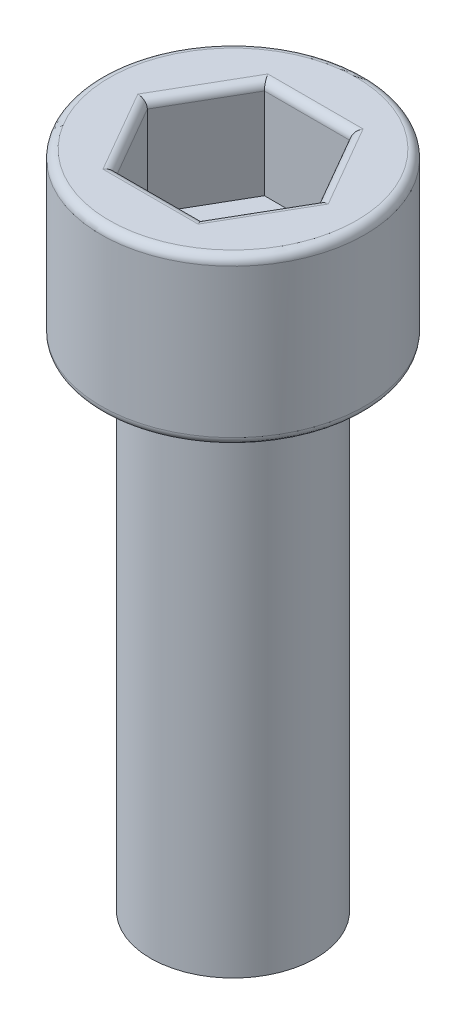
from build123d import *

# Parameters (mm, degrees)
CUT_EXTRUDE1_DEPTH = 3
FILLET1_R          = 0.25


with BuildPart() as part:
    # Sketch2 → Revolve1 (revolve)
    with BuildSketch(Plane.XY, mode=Mode.PRIVATE) as revolve1_sk:
        Polygon((0, 5), (4, 5), (4, 0), (2.5, 0), (2.5, -15), (0, -15), align=None)
    revolve(revolve1_sk.sketch.rotate(Axis((0, 21.322324325, 0), (0, -1, 0)), 180), axis=Axis((0, 21.322324325, 0), (0, -1, 0)))

    # Sketch3 → Cut-Extrude1 (cut)
    with BuildSketch(Plane(origin=(0, 5, 0), x_dir=(1, 0, 0), z_dir=(0, 1, 0))):
        Polygon((2.598076211, 0), (1.299038106, 2.25), (-1.299038106, 2.25), (-2.598076211, 0), (-1.299038106, -2.25), (1.299038106, -2.25), align=None)
    extrude(amount=-CUT_EXTRUDE1_DEPTH, mode=Mode.SUBTRACT)

    # Fillet1
    fillet1_edges = [part.edges().sort_by_distance(p)[0] for p in [
        (1.948557159, 5, 1.125),
        (1.948557159, 5, -1.125),
        (0, 5, -2.25),
        (-1.948557159, 5, -1.125),
        (-1.948557159, 5, 1.125),
        (0, 5, 2.25),
        (2.5, 0, 0),
        (4, 0, 0),
        (4, 5, 0),
    ]]
    fillet(fillet1_edges, radius=FILLET1_R)


solid = part.part
